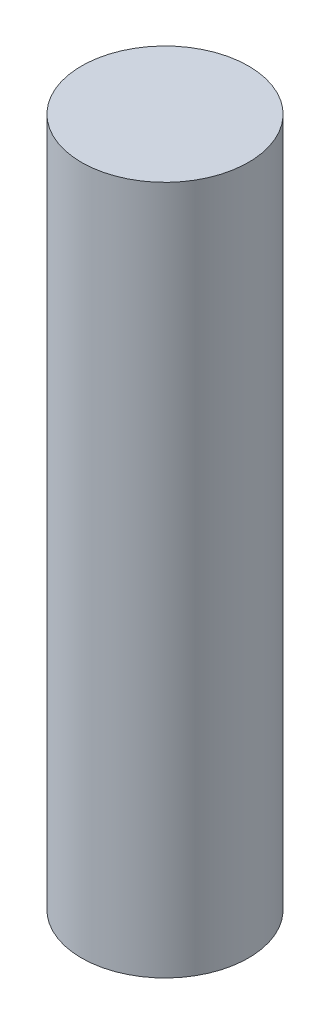
from build123d import *

# Parameters (mm, degrees)
SKETCH1_R           = 20
BOSS_EXTRUDE1_DEPTH = 165
SCALE1_SCALE        = 0.75


with BuildPart() as part:
    # Sketch1 → Boss-Extrude1 (new body)
    with BuildSketch(Plane(origin=(0, 0, 0), x_dir=(1, 0, 0), z_dir=(0, 1, 0))):
        with Locations(Location((0, 0, 0), (0, 0, 270))):
            Circle(SKETCH1_R)
    extrude(amount=BOSS_EXTRUDE1_DEPTH)


with BuildPart() as part_1:
    # Scale1: scaled about (0, 82.5, 0)
    add(part.part.scale(SCALE1_SCALE).moved(Location((0, 20.625, 0))))


solid = part_1.part
